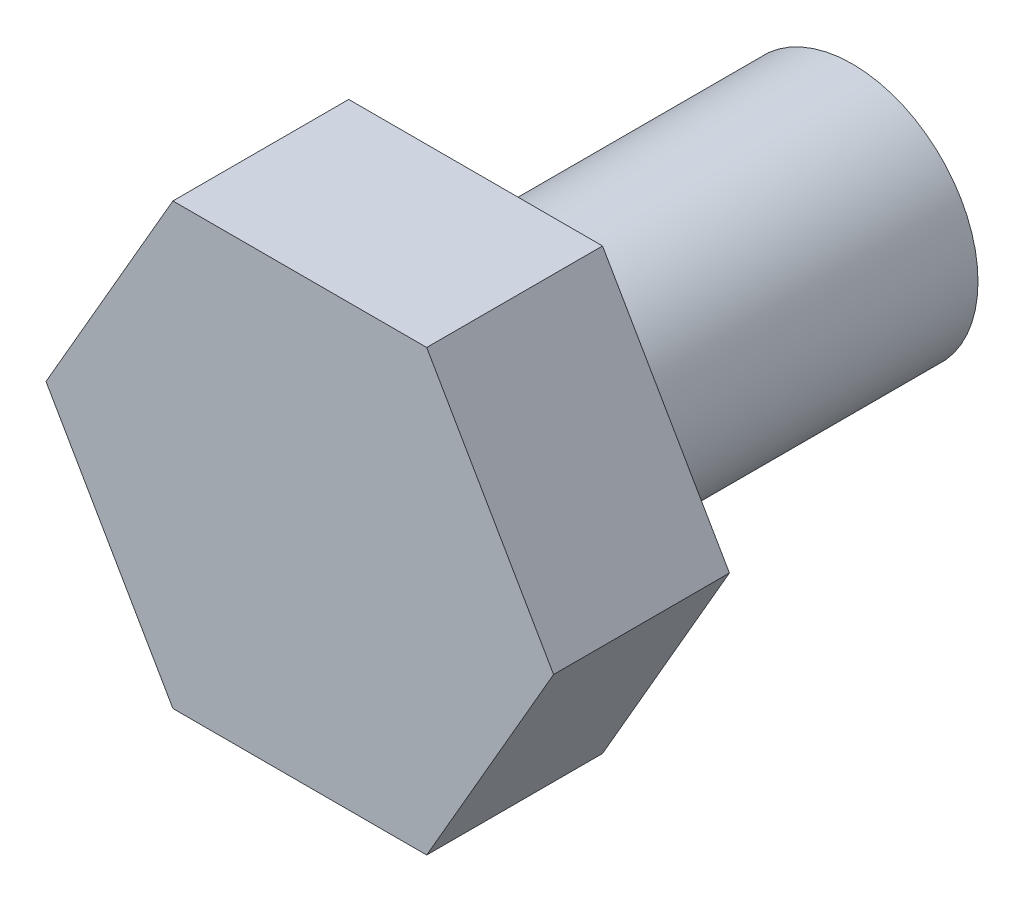
from build123d import *

# Parameters (mm, degrees)
SKETCH1_R      = 2
EXTRUDE1_DEPTH = 6
EXTRUDE2_DEPTH = 2.8


with BuildPart() as part:
    # Sketch1 → Extrude1 (new body)
    with BuildSketch(Plane.XY):
        Circle(SKETCH1_R)
    extrude(amount=-EXTRUDE1_DEPTH)

    # Sketch2 → Extrude2 (add)
    with BuildSketch(Plane.XY):
        Polygon((-2.020725942, 3.5), (-4.041451884, 0), (-2.020725942, -3.5), (2.020725942, -3.5), (4.041451884, 0), (2.020725942, 3.5), align=None)
    extrude(amount=EXTRUDE2_DEPTH)


solid = part.part
